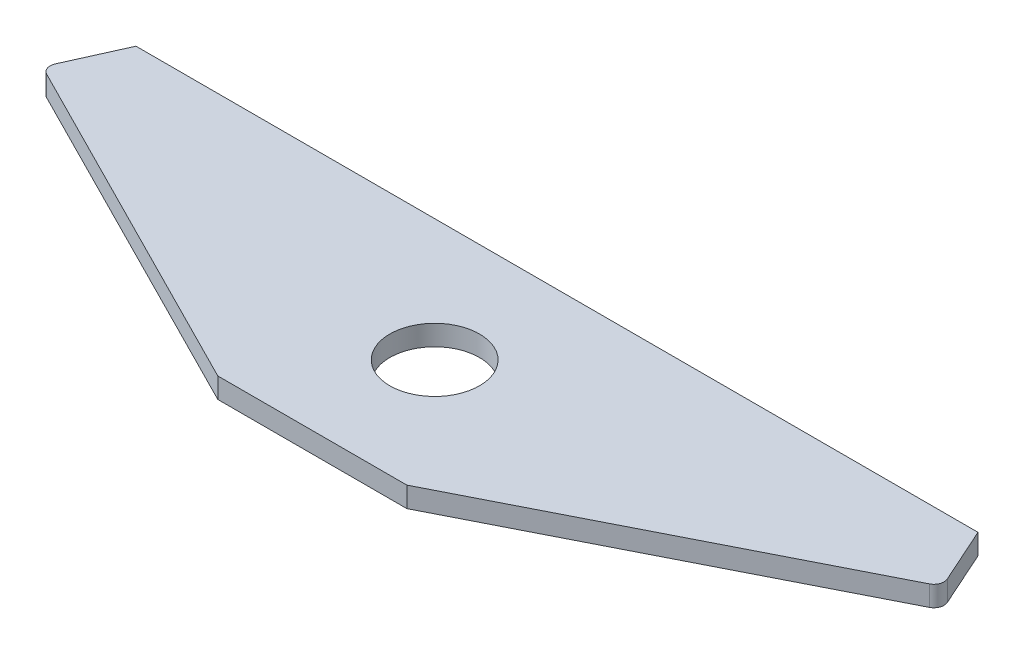
from build123d import *

# Parameters (mm, degrees)
BOSS_EXTRUDE1_DEPTH = 10
SKETCH2_R           = 22
CUT_EXTRUDE1_DEPTH  = 10


with BuildPart() as part:
    # Sketch1 → Boss-Extrude1 (new body)
    with BuildSketch(Plane(origin=(0, 0, 0), x_dir=(1, 0, 0), z_dir=(0, 1, 0))):
        with BuildLine():
            Line((224.059047254, 44.109057501), (-188.882980363, 44.109057501))
            Line((-188.882980363, 44.109057501), (-201.155616653, 16.794241143))
            ThreePointArc((-201.155616653, 16.794241143), (-201.308951392, 13.078635624), (-198.854573143, 10.28484549))
            Line((-198.854573143, 10.28484549), (-28.764010839, -75.890942499))
            Line((-28.764010839, -75.890942499), (17.588033446, -75.890942499))
            Line((17.588033446, -75.890942499), (63.94007773, -75.890942499))
            Line((63.94007773, -75.890942499), (234.030640034, 10.28484549))
            ThreePointArc((234.030640034, 10.28484549), (236.485018284, 13.078635624), (236.331683544, 16.794241143))
            Line((236.331683544, 16.794241143), (224.059047254, 44.109057501))
        make_face()
    extrude(amount=BOSS_EXTRUDE1_DEPTH)

    # Sketch2 → Cut-Extrude1 (cut)
    with BuildSketch(Plane(origin=(0, 10, 0), x_dir=(1, 0, 0), z_dir=(0, 1, 0))):
        with Locations(Location((17.588033446, -15.890942499, 0), (0, 0, 270))):
            Circle(SKETCH2_R)
    extrude(amount=-CUT_EXTRUDE1_DEPTH, mode=Mode.SUBTRACT)


solid = part.part
